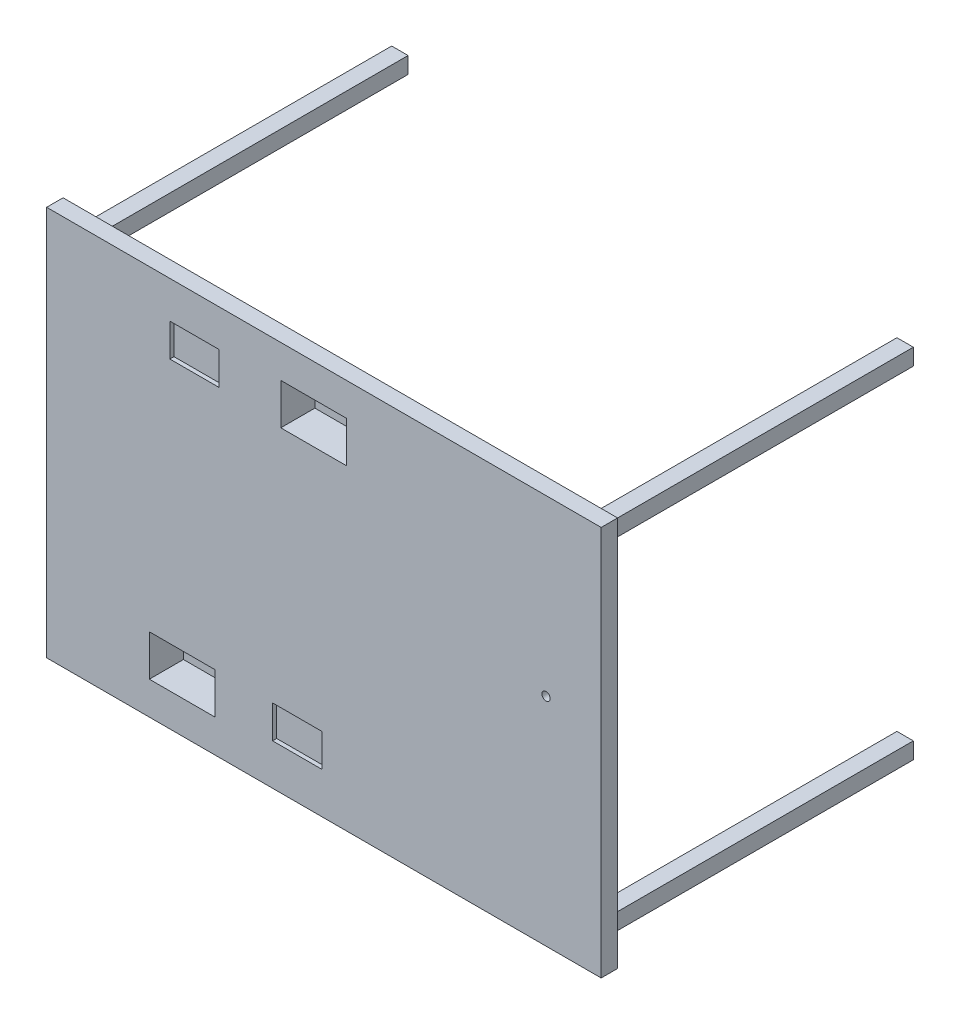
from build123d import *

# Parameters (mm, degrees)
ESQUISSE1_W               = 1350
ESQUISSE1_H               = 950
ESQUISSE1_W_2             = 1270
ESQUISSE1_H_2             = 870
BOSS_EXTRU_1_DEPTH        = 40
BOSS_EXTRU_2_DEPTH        = 760
BOSS_EXTRU_2_DEPTH_BACK   = 22
ESQUISSE2_W               = 40
ESQUISSE2_H               = 40
BOSS_EXTRU_2_2_DEPTH      = 760
BOSS_EXTRU_2_2_DEPTH_BACK = 22
BOSS_EXTRU_2_3_DEPTH      = 760
BOSS_EXTRU_2_3_DEPTH_BACK = 22
BOSS_EXTRU_2_4_DEPTH      = 760
BOSS_EXTRU_2_4_DEPTH_BACK = 22
ESQUISSE3_W               = 1270
ESQUISSE3_H               = 870
BOSS_EXTRU_3_DEPTH        = 18
ESQUISSE4_W               = 160
ESQUISSE4_H               = 100
ENL_V_MAT_EXTRU_1_DEPTH   = 1835.393632784
ESQUISSE5_W               = 180
ESQUISSE5_H               = 120
ESQUISSE5_W_2             = 160
ESQUISSE5_H_2             = 100
BOSS_EXTRU_4_DEPTH        = 65
ESQUISSE6_W               = 180
ESQUISSE6_H               = 120
BOSS_EXTRU_5_DEPTH        = 10
ESQUISSE7_W               = 120
ESQUISSE7_H               = 80
ENL_V_MAT_EXTRU_2_DEPTH   = 10
ESQUISSE8_R               = 10
ENL_V_MAT_EXTRU_3_DEPTH   = 1827.615449404


with BuildPart() as part:
    # Esquisse1 → Boss.-Extru.1 (new body)
    with BuildSketch(Plane.XY):
        with Locations((675, -475)):
            Rectangle(ESQUISSE1_W, ESQUISSE1_H)
        with Locations((675, -475)):
            Rectangle(ESQUISSE1_W_2, ESQUISSE1_H_2, mode=Mode.SUBTRACT)
    extrude(amount=BOSS_EXTRU_1_DEPTH)



with BuildPart() as body_2:
    # Esquisse2 → Boss.-Extru.2 (new, two sides: drawn at the far end of the back side and taken through both)
    with BuildSketch(Plane(origin=(0, 0, 0), x_dir=(-1, 0, 0), z_dir=(0, 0, -1)).offset(-BOSS_EXTRU_2_DEPTH_BACK)):
        with Locations((-1290, -60)):
            Rectangle(ESQUISSE2_W, ESQUISSE2_H)
    extrude(amount=BOSS_EXTRU_2_DEPTH + BOSS_EXTRU_2_DEPTH_BACK)


with BuildPart() as body_3:
    # Esquisse2 → Boss.-Extru.2 2 (new, two sides: drawn at the far end of the back side and taken through both)
    with BuildSketch(Plane(origin=(0, 0, 0), x_dir=(-1, 0, 0), z_dir=(0, 0, -1)).offset(-BOSS_EXTRU_2_2_DEPTH_BACK)):
        with Locations((-60, -60)):
            Rectangle(ESQUISSE2_W, ESQUISSE2_H)
    extrude(amount=BOSS_EXTRU_2_2_DEPTH + BOSS_EXTRU_2_2_DEPTH_BACK)


with BuildPart() as body_4:
    # Esquisse2 → Boss.-Extru.2 3 (new, two sides: drawn at the far end of the back side and taken through both)
    with BuildSketch(Plane(origin=(0, 0, 0), x_dir=(-1, 0, 0), z_dir=(0, 0, -1)).offset(-BOSS_EXTRU_2_3_DEPTH_BACK)):
        with Locations((-60, -890)):
            Rectangle(ESQUISSE2_W, ESQUISSE2_H)
    extrude(amount=BOSS_EXTRU_2_3_DEPTH + BOSS_EXTRU_2_3_DEPTH_BACK)


with BuildPart() as body_5:
    # Esquisse2 → Boss.-Extru.2 4 (new, two sides: drawn at the far end of the back side and taken through both)
    with BuildSketch(Plane(origin=(0, 0, 0), x_dir=(-1, 0, 0), z_dir=(0, 0, -1)).offset(-BOSS_EXTRU_2_4_DEPTH_BACK)):
        with Locations((-1290, -890)):
            Rectangle(ESQUISSE2_W, ESQUISSE2_H)
    extrude(amount=BOSS_EXTRU_2_4_DEPTH + BOSS_EXTRU_2_4_DEPTH_BACK)


with BuildPart() as body_6:
    # Esquisse3 → Boss.-Extru.3 (new body)
    with BuildSketch(Plane.XY.offset(22)):
        with Locations((675, -475)):
            Rectangle(ESQUISSE3_W, ESQUISSE3_H)
    extrude(amount=BOSS_EXTRU_3_DEPTH)

    # Esquisse4 → Enlèv. mat.-Extru.1 (cut, through all)
    with BuildSketch(Plane.XY.offset(40)):
        with Locations((330, -820)):
            Rectangle(ESQUISSE4_W, ESQUISSE4_H)
        with Locations((650, -130)):
            Rectangle(ESQUISSE4_W, ESQUISSE4_H)
    extrude(amount=-ENL_V_MAT_EXTRU_1_DEPTH, mode=Mode.SUBTRACT)


with BuildPart() as part_1:
    add(part.part)

    add(body_6.part)  # Boss.-Extru.4 merges body 6
    # Esquisse5 → Boss.-Extru.4 (add)
    # profile 1 of 2: a face of its own
    with BuildSketch(Plane(origin=(0, 0, 22), x_dir=(-1, 0, 0), z_dir=(0, 0, -1))):
        with Locations((-330, -820)):
            Rectangle(ESQUISSE5_W, ESQUISSE5_H)
        with Locations((-330, -820)):
            Rectangle(ESQUISSE5_W_2, ESQUISSE5_H_2, mode=Mode.SUBTRACT)
    # profile 2 of 2: a face of its own
    with BuildSketch(Plane(origin=(0, 0, 22), x_dir=(-1, 0, 0), z_dir=(0, 0, -1))):
        with Locations((-650, -130)):
            Rectangle(ESQUISSE5_W, ESQUISSE5_H)
        with Locations((-650, -130)):
            Rectangle(ESQUISSE5_W_2, ESQUISSE5_H_2, mode=Mode.SUBTRACT)
    extrude(amount=BOSS_EXTRU_4_DEPTH)

    # Esquisse6 → Boss.-Extru.5 (add)
    with BuildSketch(Plane(origin=(0, 0, -43), x_dir=(-1, 0, 0), z_dir=(0, 0, -1))):
        with Locations((-650, -130)):
            Rectangle(ESQUISSE6_W, ESQUISSE6_H)
        with Locations((-330, -820)):
            Rectangle(ESQUISSE6_W, ESQUISSE6_H)
    extrude(amount=BOSS_EXTRU_5_DEPTH)

    # Esquisse7 → Enlèv. mat.-Extru.2 (cut)
    with BuildSketch(Plane.XY.offset(40)):
        with Locations((360, -130)):
            Rectangle(ESQUISSE7_W, ESQUISSE7_H)
        with Locations((610, -810)):
            Rectangle(ESQUISSE7_W, ESQUISSE7_H)
    extrude(amount=-ENL_V_MAT_EXTRU_2_DEPTH, mode=Mode.SUBTRACT)

    # Esquisse8 → Enlèv. mat.-Extru.3 (cut, through all)
    with BuildSketch(Plane(origin=(0, 0, 22), x_dir=(-1, 0, 0), z_dir=(0, 0, -1))):
        with Locations((-1215.801110786, -423)):
            Circle(ESQUISSE8_R)
    extrude(amount=-ENL_V_MAT_EXTRU_3_DEPTH, mode=Mode.SUBTRACT)


solid = Compound([body_2.part, body_3.part, body_4.part, body_5.part, part_1.part])
